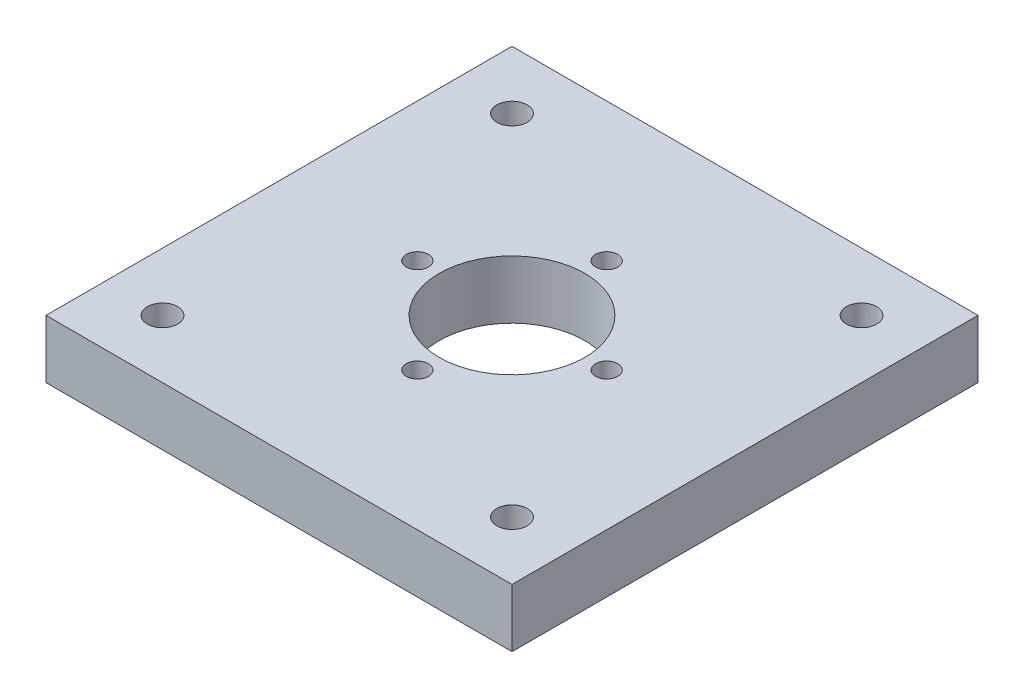
from build123d import *

# Parameters (mm, degrees)
SKETCH2_W           = 101.6
SKETCH2_H           = 101.6
BOSS_EXTRUDE1_DEPTH = 6.35
SKETCH3_R           = 3.302
CUT_EXTRUDE1_DEPTH  = 73.955945611
SKETCH4_R           = 15.875
SKETCH4_R_2         = 2.413
CUT_EXTRUDE2_DEPTH  = 73.955945611


with BuildPart() as part:
    # Sketch2 → Boss-Extrude1 (new, symmetric)
    with BuildSketch(Plane(origin=(0, 0, 0), x_dir=(1, 0, 0), z_dir=(0, 1, 0))):
        Rectangle(SKETCH2_W, SKETCH2_H)
    extrude(amount=BOSS_EXTRUDE1_DEPTH, both=True)

    # Sketch3 → Cut-Extrude1 (cut, through all)
    with BuildSketch(Plane(origin=(0, 6.35, 0), x_dir=(1, 0, 0), z_dir=(0, 1, 0))):
        with Locations(Location((-38.1, -38.1, 0), (0, 0, 270))):
            Circle(SKETCH3_R)
        with Locations(Location((-38.1, 38.1, 0), (0, 0, 90))):
            Circle(SKETCH3_R)
        with Locations(Location((38.1, -38.1, 0), (0, 0, 90))):
            Circle(SKETCH3_R)
        with Locations(Location((38.1, 38.1, 0), (0, 0, 270))):
            Circle(SKETCH3_R)
    extrude(amount=-CUT_EXTRUDE1_DEPTH, mode=Mode.SUBTRACT)

    # Sketch4 → Cut-Extrude2 (cut, through all)
    with BuildSketch(Plane(origin=(0, 6.35, 0), x_dir=(1, 0, 0), z_dir=(0, 1, 0))):
        with Locations(Location((0, 0, 0), (0, 0, 270))):
            Circle(SKETCH4_R)
        with Locations(Location((0, 20.6375, 0), (0, 0, 270))):
            Circle(SKETCH4_R_2)
        with Locations(Location((20.6375, 0, 0), (0, 0, 270))):
            Circle(SKETCH4_R_2)
        with Locations(Location((0, -20.6375, 0), (0, 0, 270))):
            Circle(SKETCH4_R_2)
        with Locations(Location((-20.6375, 0, 0), (0, 0, 270))):
            Circle(SKETCH4_R_2)
    extrude(amount=-CUT_EXTRUDE2_DEPTH, mode=Mode.SUBTRACT)


solid = part.part
